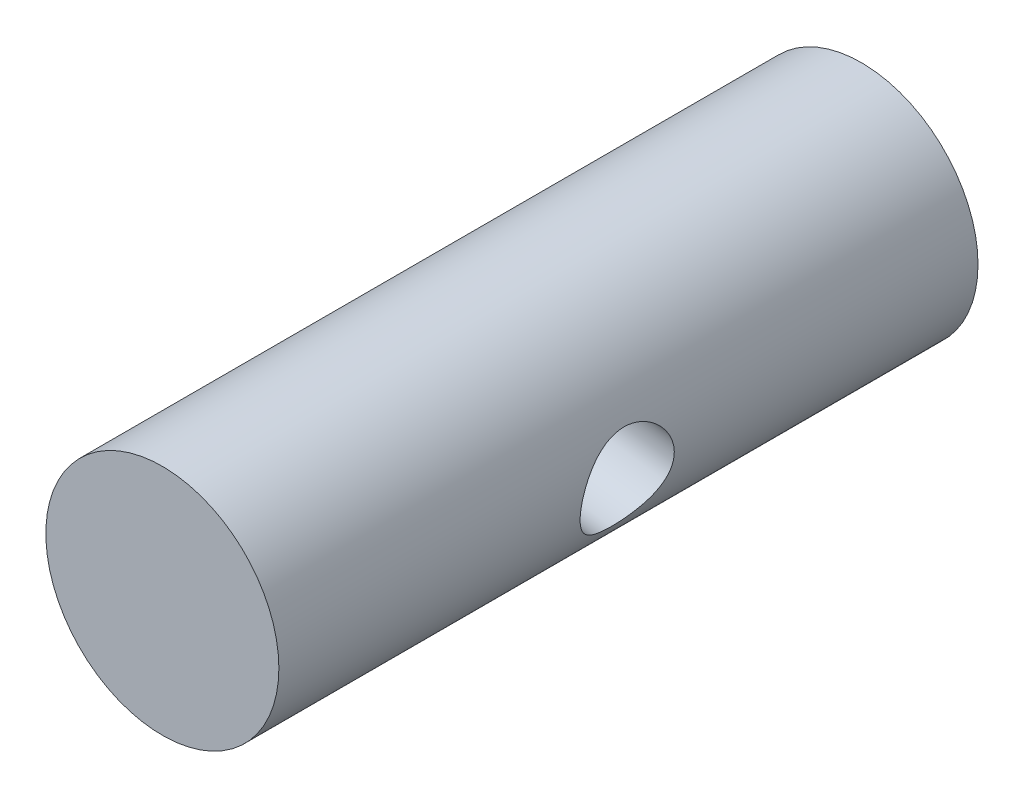
from build123d import *

# Parameters (mm, degrees)
SKETCH1_R               = 7.5
BOSS_EXTRUDE1_DEPTH     = 45
CUT_EXTRUDE1_DEPTH      = 49.283417978
CUT_EXTRUDE1_DEPTH_BACK = 49.283417978
SKETCH3_R               = 3


with BuildPart() as part:
    # Sketch1 → Boss-Extrude1 (new body)
    with BuildSketch(Plane.XY):
        with Locations(Location((-33.576617472, 12.446104402, 0), (0, 0, 180))):
            Circle(SKETCH1_R)
    extrude(amount=BOSS_EXTRUDE1_DEPTH)

    # Sketch3 → Cut-Extrude1 (cut, two sides: drawn at the far end of the back side and taken through both)
    with BuildSketch(Plane(origin=(-34.625853262, 4.675249186, 0), x_dir=(-0.133807710197383, -0.9910073141464362, 0), z_dir=(-0.9910073141464362, 0.133807710197383, 0)).offset(-CUT_EXTRUDE1_DEPTH_BACK)):
        with Locations((-7.841370195, 22.5)):
            Circle(SKETCH3_R)
    extrude(amount=CUT_EXTRUDE1_DEPTH + CUT_EXTRUDE1_DEPTH_BACK, mode=Mode.SUBTRACT)


solid = part.part
